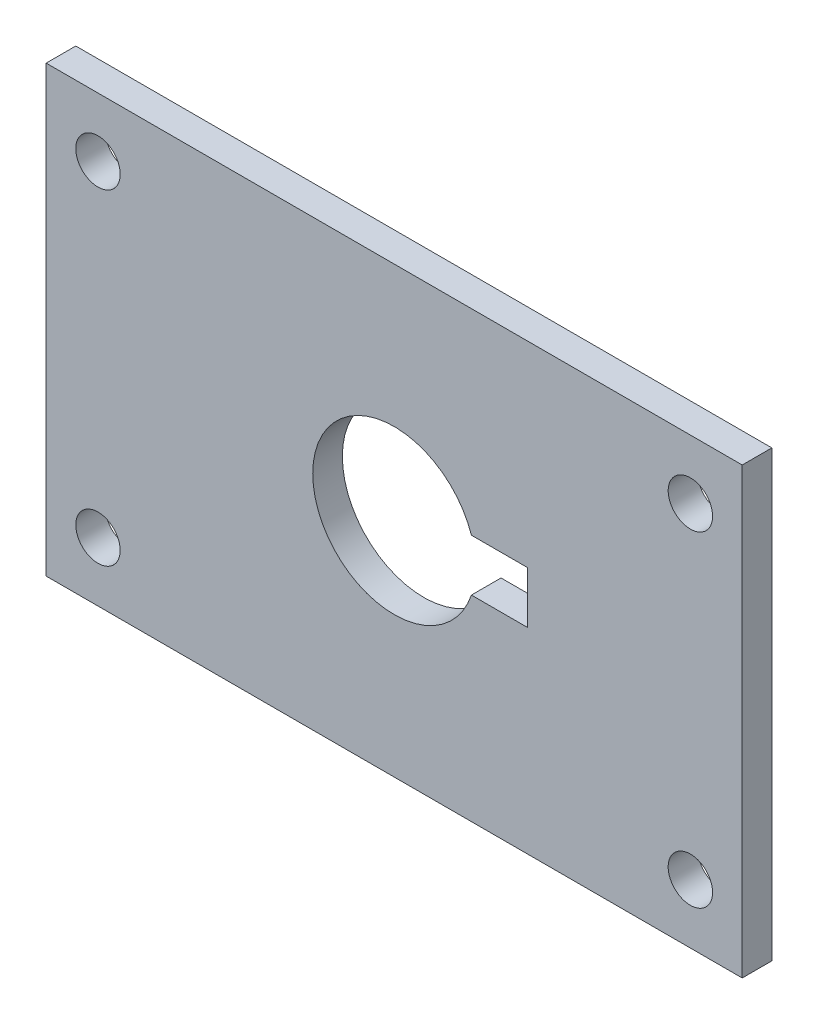
from build123d import *

# Parameters (mm, degrees)
SKETCH_1_W          = 47
SKETCH_1_H          = 30
EXTRUDE_1_DEPTH     = 2
SKETCH_2_R          = 5.5
CUT_EXTRUDE_1_DEPTH = 56.794264938
SKETCH_3_W          = 7
SKETCH_3_H          = 3.5
CUT_EXTRUDE_2_DEPTH = 56.794264938
SKETCH_4_R          = 1.5
CUT_EXTRUDE_3_DEPTH = 56.794264938


with BuildPart() as part:
    # Эскиз1 → Бобышка-Вытянуть1 (new body)
    with BuildSketch(Plane.XY):
        with Locations((23.5, 15)):
            Rectangle(SKETCH_1_W, SKETCH_1_H)
    extrude(amount=EXTRUDE_1_DEPTH)

    # Эскиз2 → Вырез-Вытянуть1 (cut, through all)
    with BuildSketch(Plane.XY.offset(2)):
        with Locations((23.5, 15)):
            Circle(SKETCH_2_R)
    extrude(amount=-CUT_EXTRUDE_1_DEPTH, mode=Mode.SUBTRACT)

    # Эскиз3 → Вырез-Вытянуть2 (cut, through all)
    with BuildSketch(Plane.XY.offset(2)):
        with Locations((29, 15)):
            Rectangle(SKETCH_3_W, SKETCH_3_H)
    extrude(amount=-CUT_EXTRUDE_2_DEPTH, mode=Mode.SUBTRACT)

    # Эскиз4 → Вырез-Вытянуть3 (cut, through all)
    with BuildSketch(Plane.XY.offset(2)):
        with Locations((3.5, 4)):
            Circle(SKETCH_4_R)
        with Locations((43.5, 4)):
            Circle(SKETCH_4_R)
        with Locations((43.5, 26)):
            Circle(SKETCH_4_R)
        with Locations((3.5, 26)):
            Circle(SKETCH_4_R)
    extrude(amount=-CUT_EXTRUDE_3_DEPTH, mode=Mode.SUBTRACT)


solid = part.part
